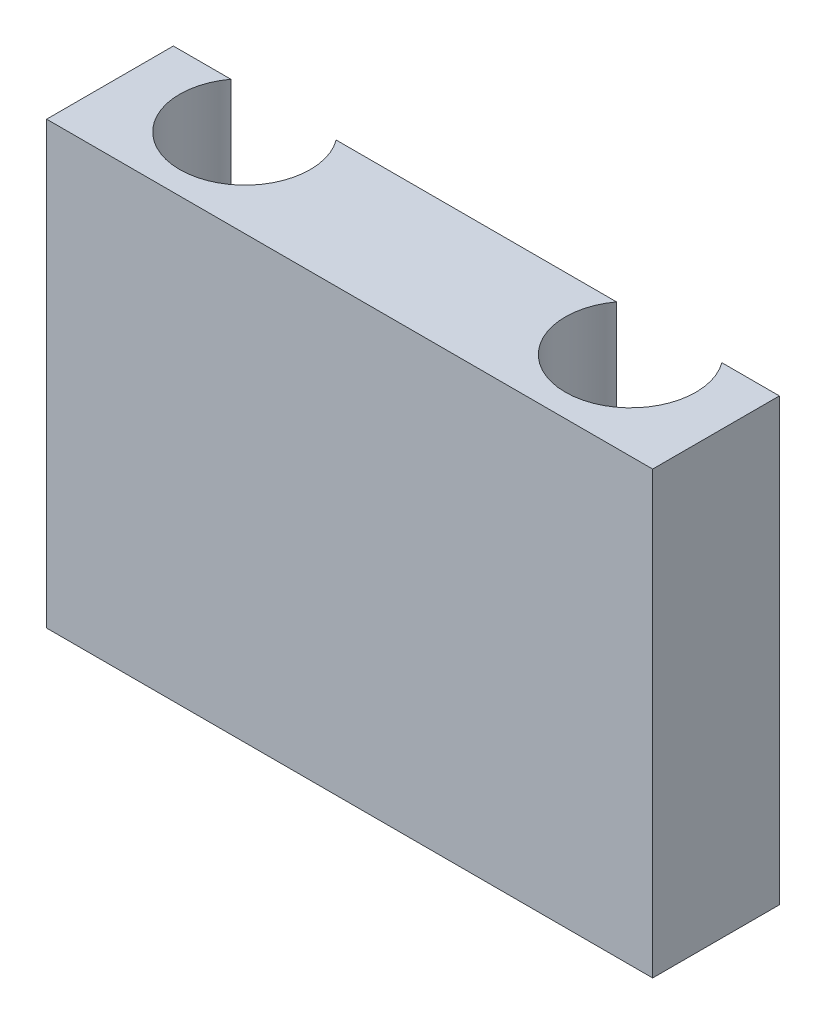
from build123d import *

# Parameters (mm, degrees)
SKETCH2_W                    = 110
SKETCH2_H                    = 80
BOSS_EXTRUDE1_DEPTH          = 23
SKETCH3_R                    = 9.1
THREAD_EXTRUDE_DEPTH         = 45
SKETCH5_R                    = 11.85
NUT_EXTRUDE_DEPTH            = 17
SKETCH6_R                    = 8.4
MINOR_DIANETER_EXTRUDE_DEPTH = 64
CABLE_EXTRUDE_DEPTH          = 138.945641468


with BuildPart() as part:
    # Sketch2 → Boss-Extrude1 (new body)
    with BuildSketch(Plane.XY):
        with Locations((55, 40)):
            Rectangle(SKETCH2_W, SKETCH2_H)
    extrude(amount=BOSS_EXTRUDE1_DEPTH)

    # Sketch3 → Thread extrude (cut)
    with BuildSketch(Plane(origin=(0, 80, 0), x_dir=(1, 0, 0), z_dir=(0, 1, 0))):
        with Locations((20, -7)):
            Circle(SKETCH3_R)
        with Locations((90, -7)):
            Circle(SKETCH3_R)
    extrude(amount=-THREAD_EXTRUDE_DEPTH, mode=Mode.SUBTRACT)

    # Sketch5 → Nut extrude (cut)
    with BuildSketch(Plane(origin=(0, 80, 0), x_dir=(1, 0, 0), z_dir=(0, 1, 0))):
        with Locations((20, -7)):
            Circle(SKETCH5_R)
        with Locations((90, -7)):
            Circle(SKETCH5_R)
    extrude(amount=-NUT_EXTRUDE_DEPTH, mode=Mode.SUBTRACT)

    # Sketch6 → minor dianeter extrude (cut)
    with BuildSketch(Plane(origin=(0, 80, 0), x_dir=(1, 0, 0), z_dir=(0, 1, 0))):
        with Locations((20, -7)):
            Circle(SKETCH6_R)
        with Locations((90, -7)):
            Circle(SKETCH6_R)
    extrude(amount=-MINOR_DIANETER_EXTRUDE_DEPTH, mode=Mode.SUBTRACT)

    # Sketch4 → Cable extrude (cut, through all)
    with BuildSketch(Plane(origin=(0, 80, 0), x_dir=(1, 0, 0), z_dir=(0, 1, 0))):
        with BuildLine():
            Line((17, -7), (17, 0))
            Line((17, 0), (23, 0))
            Line((23, 0), (23, -7))
            ThreePointArc((23, -7), (20, -10), (17, -7))
        make_face()
        with BuildLine():
            Line((87, -7), (87, 0))
            Line((87, 0), (93, 0))
            Line((93, 0), (93, -7))
            ThreePointArc((93, -7), (90, -10), (87, -7))
        make_face()
    extrude(amount=-CABLE_EXTRUDE_DEPTH, mode=Mode.SUBTRACT)


solid = part.part
